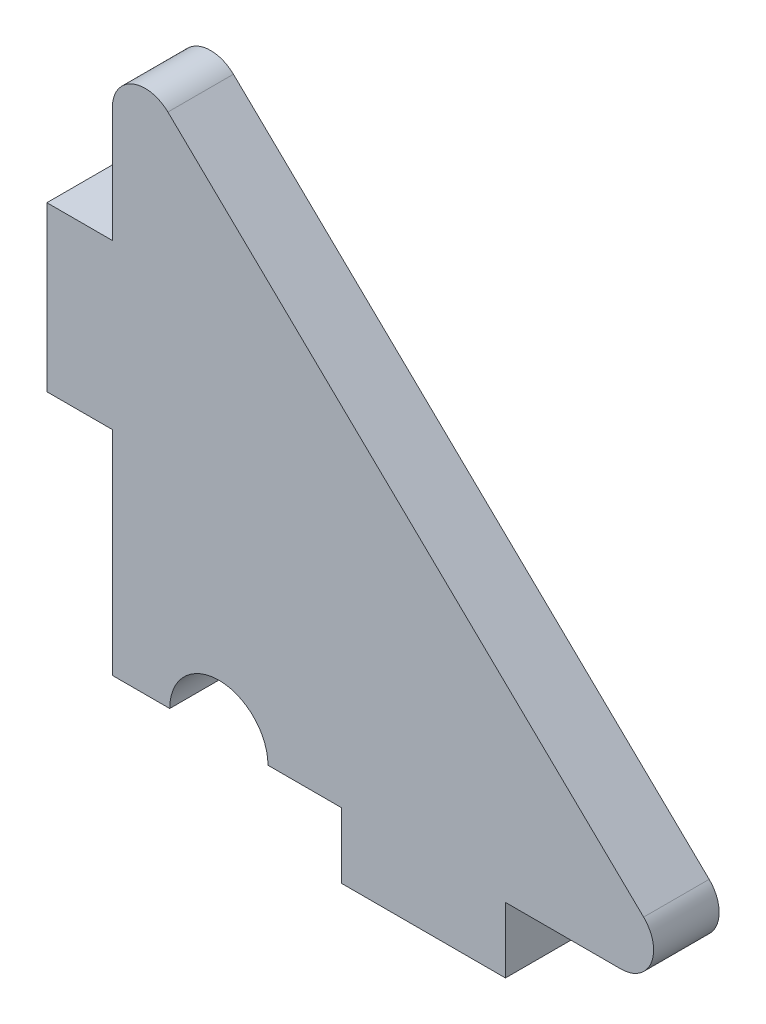
from build123d import *

# Parameters (mm, degrees)
BOSS_EXTRUDE1_DEPTH = 4


with BuildPart() as part:
    # Sketch1 → Boss-Extrude1 (new body)
    with BuildSketch(Plane.XY):
        with BuildLine():
            Line((0, 0), (3.5, 0))
            ThreePointArc((3.5, 0), (6.5, 3), (9.5, 0))
            Line((9.5, 0), (14, 0))
            Line((14, 0), (14, -4))
            Line((14, -4), (24, -4))
            Line((24, -4), (24, 0))
            Line((24, 0), (31.049410002, 0))
            ThreePointArc((31.049410002, 0), (32.903799592, 1.250840974), (32.438642701, 3.438760754))
            Line((32.438642701, 3.438760754), (3.3892327, 31.488170756))
            ThreePointArc((3.3892327, 31.488170756), (1.218483973, 31.890396884), (0, 30.049410002))
            Line((0, 30.049410002), (0, 23))
            Line((0, 23), (-4, 23))
            Line((-4, 23), (-4, 13))
            Line((-4, 13), (0, 13))
            Line((0, 13), (0, 0))
        make_face()
    extrude(amount=BOSS_EXTRUDE1_DEPTH)


solid = part.part
